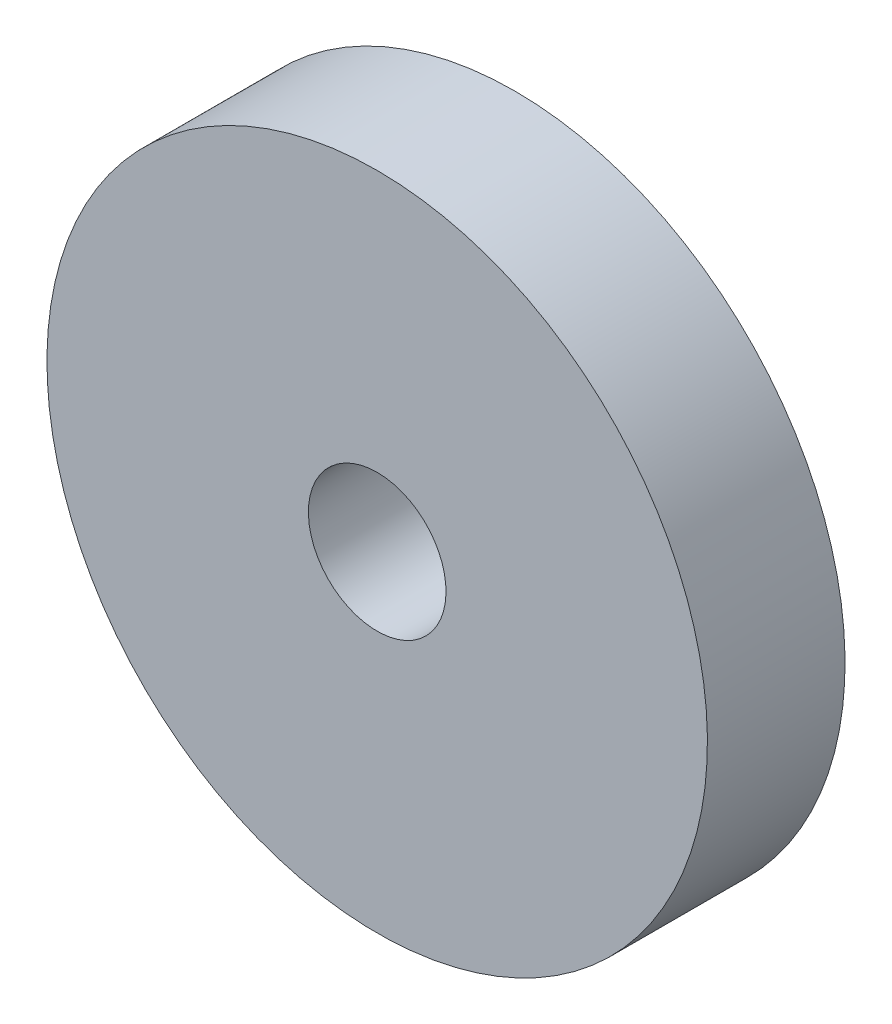
from build123d import *

# Parameters (mm, degrees)
SKETCH_1_W    = 4.75
SKETCH_1_H    = 2.5
SCALE_1_SCALE = 2


with BuildPart() as part:
    # 草图1 → 旋转1 (revolve)
    with BuildSketch(Plane.XZ, mode=Mode.PRIVATE) as revolve_1_sk:
        with Locations((2.625, 8.75)):
            Rectangle(SKETCH_1_W, SKETCH_1_H)
    revolve(revolve_1_sk.sketch.rotate(Axis((-1, 0, 10), (0, 0, -1)), 270), axis=Axis((-1, 0, 10), (0, 0, -1)))


with BuildPart() as part_1:
    # 缩放比例1: scaled about (-1, 0, 8.75)
    add(part.part.scale(SCALE_1_SCALE).moved(Location((1, 0, -8.75))))


solid = part_1.part
